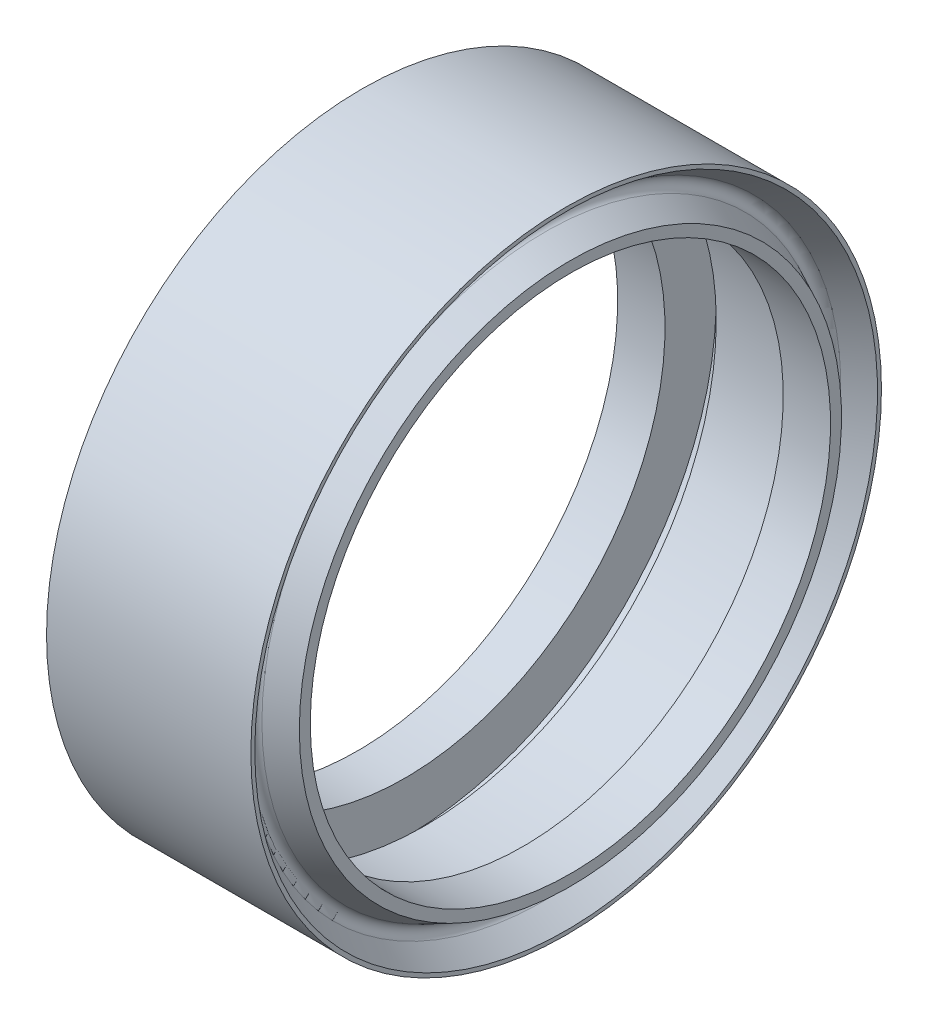
from build123d import *


with BuildPart() as part:
    # Croquis1 → Revolución1 (revolve)
    with BuildSketch(Plane.XY, mode=Mode.PRIVATE) as revoluci_n1_sk:
        with BuildLine():
            Line((10.846100741, 34.389443091), (14.068704784, 35.913637022))
            ThreePointArc((14.068704784, 35.913637022), (14.638684043, 36.747496005), (14.19097791, 37.652899991))
            Line((14.19097791, 37.652899991), (11.384961428, 39.5))
            Line((11.384961428, 39.5), (11.384961428, 40))
            Line((11.384961428, 40), (37.307240053, 40))
            Line((37.307240053, 40), (37.307240053, 39.5))
            Line((37.307240053, 39.5), (34.501223571, 37.652899991))
            ThreePointArc((34.501223571, 37.652899991), (34.053517438, 36.747496005), (34.623496697, 35.913637022))
            Line((34.623496697, 35.913637022), (37.846100741, 34.389443091))
            Line((37.846100741, 34.389443091), (37.846100741, 33))
            Line((37.846100741, 33), (31.846100741, 33))
            Line((31.846100741, 33), (31.846100741, 39.5))
            Line((31.846100741, 39.5), (29.346100741, 39.5))
            Line((29.346100741, 39.5), (29.346100741, 37))
            Line((29.346100741, 37), (19.346100741, 37))
            Line((19.346100741, 37), (19.346100741, 39.5))
            Line((19.346100741, 39.5), (16.846100741, 39.5))
            Line((16.846100741, 39.5), (16.846100741, 33))
            Line((16.846100741, 33), (10.846100741, 33))
            Line((10.846100741, 33), (10.846100741, 34.389443091))
        make_face()
    revolve(revoluci_n1_sk.sketch.rotate(Axis((0, 0, 0), (1, 0, 0)), 90), axis=Axis((0, 0, 0), (1, 0, 0)))


solid = part.part
